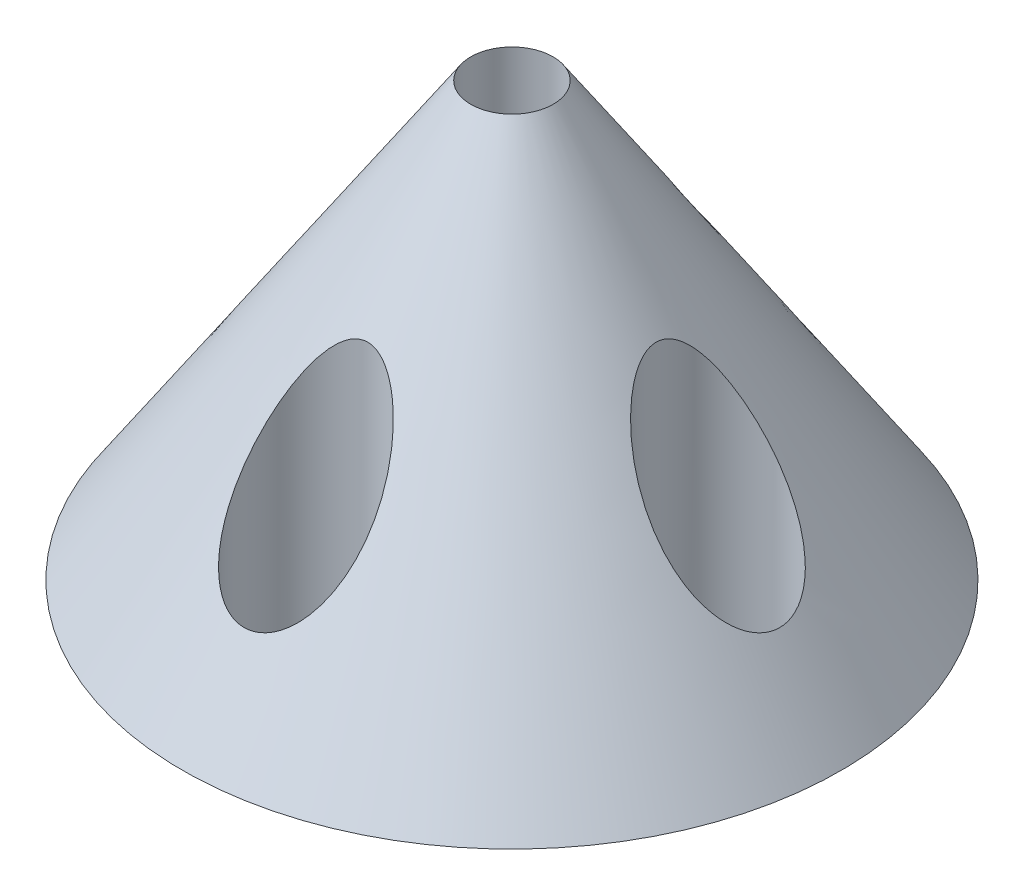
from build123d import *

# Parameters (mm, degrees)
SKETCH3_R          = 0.75
SKETCH3_R_2        = 0.5
CUT_EXTRUDE1_DEPTH = 6
SKETCH3_3_R        = 1.5
CUT_EXTRUDE2_DEPTH = 2


with BuildPart() as part:
    # Sketch1 → Revolve1 (revolve)
    with BuildSketch(Plane(origin=(0, 0, 0), x_dir=(0, 0, -1), z_dir=(1, 0, 0))):
        Polygon((0, 0), (4, 0), (0, 6), align=None)
    revolve(axis=Axis((0, -11.26056338, 0), (0, 1, 0)))

    # Sketch3 → Cut-Extrude1 (cut)
    with BuildSketch(Plane.XZ):
        with Locations((0, -2.5)):
            Circle(SKETCH3_R)
        with Locations((0, 2.5)):
            Circle(SKETCH3_R)
        with Locations((-2.5, 0)):
            Circle(SKETCH3_R)
        with Locations((2.5, 0)):
            Circle(SKETCH3_R)
        Circle(SKETCH3_R_2)
    extrude(amount=-CUT_EXTRUDE1_DEPTH, mode=Mode.SUBTRACT)

    # Sketch3<3> → Cut-Extrude2 (cut)
    with BuildSketch(Plane.XZ):
        Circle(SKETCH3_3_R)
    extrude(amount=-CUT_EXTRUDE2_DEPTH, mode=Mode.SUBTRACT)


solid = part.part
